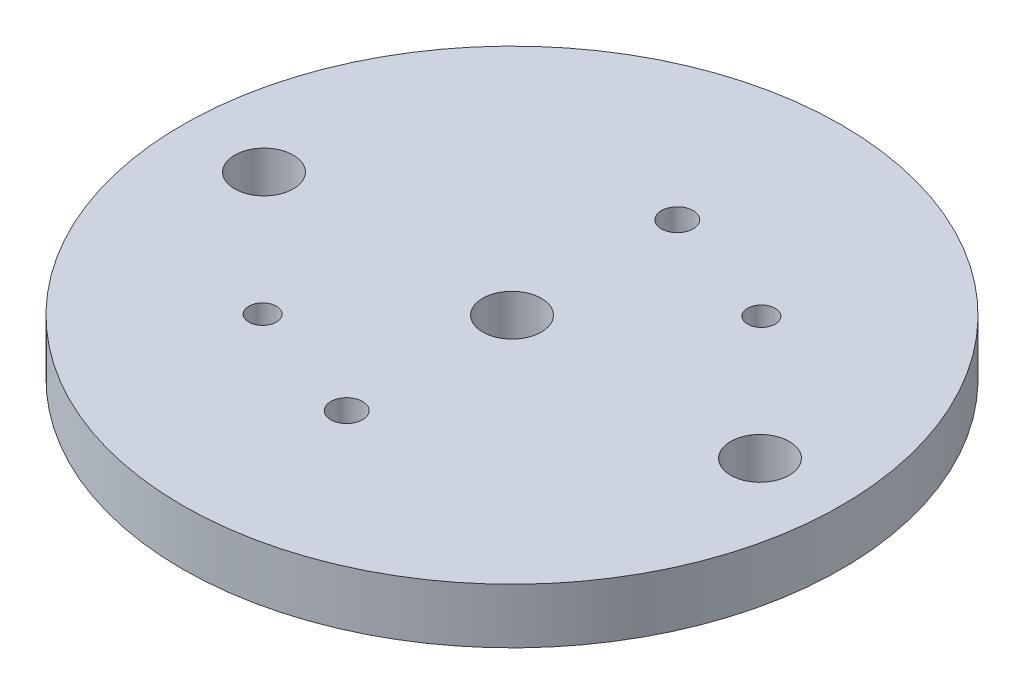
from build123d import *

# Parameters (mm, degrees)
SKETCH1_R                    = 37.973
BOSS_EXTRUDE1_DEPTH          = 3.175
H_0_266_DIAMETER_HOLE1_D     = 6.7564
F_27_0_144_DIAMETER_HOLE1_D  = 3.6576
F_1_8_0_125_DIAMETER_HOLE1_D = 3.175
H_0_266_DIAMETER_HOLE2_D     = 6.7564


with BuildPart() as part:
    # Sketch1 → Boss-Extrude1 (new, symmetric)
    with BuildSketch(Plane(origin=(0, 0, 0), x_dir=(1, 0, 0), z_dir=(0, 1, 0))):
        with Locations(Location((0, 0, 0), (0, 0, 270))):
            Circle(SKETCH1_R)
    extrude(amount=BOSS_EXTRUDE1_DEPTH, both=True)

    # H (0.266) Diameter Hole1 (through all)
    with Locations(Plane(origin=(0, 3.175, 0), x_dir=(1, 0, 0), z_dir=(0, 1, 0))):
        with Locations((-28.575, 0), (28.575, 0)):
            Hole(H_0_266_DIAMETER_HOLE1_D / 2)

    # #27 (0.144) Diameter Hole1 (through all)
    with Locations(Plane(origin=(0, 3.175, 0), x_dir=(1, 0, 0), z_dir=(0, 1, 0))):
        with Locations((0, 19.05), (0, -19.05)):
            Hole(F_27_0_144_DIAMETER_HOLE1_D / 2)

    # 1/8 (0.125) Diameter Hole1 (through all)
    with Locations(Plane(origin=(0, 3.175, 0), x_dir=(1, 0, 0), z_dir=(0, 1, 0))):
        with Locations((14.469766177, 14.266333333), (-14.469766177, -14.266333333)):
            Hole(F_1_8_0_125_DIAMETER_HOLE1_D / 2)

    # H (0.266) Diameter Hole2 (through all)
    with Locations(Plane(origin=(0, 3.175, 0), x_dir=(1, 0, 0), z_dir=(0, 1, 0))):
        with Locations((0, 0)):
            Hole(H_0_266_DIAMETER_HOLE2_D / 2)


solid = part.part
